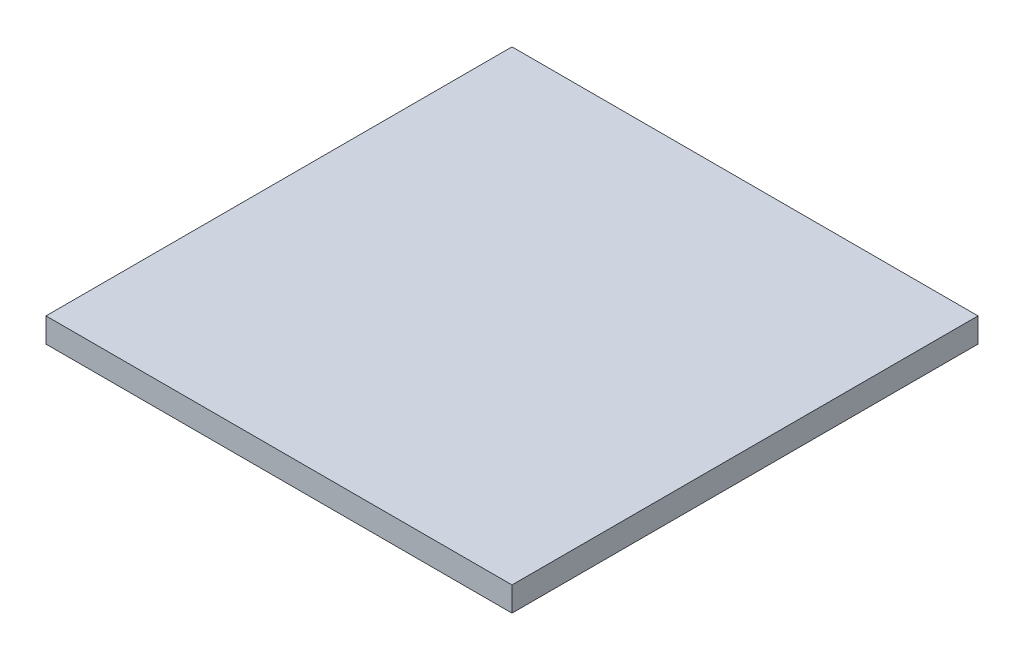
from build123d import *

# Parameters (mm, degrees)
OVEN_EGZOZ_IZGARASI_UST_1_START = -300
SKETCH1_W                       = 200
SKETCH1_H                       = 10.5
OVEN_EGZOZ_IZGARASI_UST_1_DEPTH = 200


with BuildPart() as part:
    # Sketch1 → OVEN_egzoz_izgarasi_ust_1 (new body)
    with BuildSketch(Plane.XY.offset(OVEN_EGZOZ_IZGARASI_UST_1_START)):
        with Locations((500, 1963.25)):
            Rectangle(SKETCH1_W, SKETCH1_H)
    extrude(amount=-OVEN_EGZOZ_IZGARASI_UST_1_DEPTH)


solid = part.part
